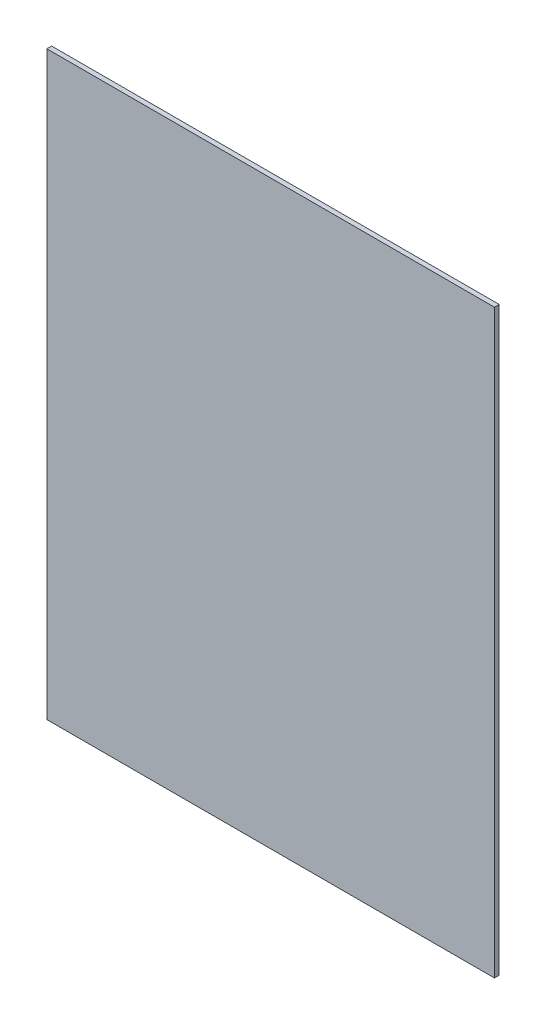
from build123d import *

# Parameters (mm, degrees)
SKETCH1_W           = 596.9
SKETCH1_H           = 774.7
BOSS_EXTRUDE1_DEPTH = 6.35


with BuildPart() as part:
    # Sketch1 → Boss-Extrude1 (new body)
    with BuildSketch(Plane.XY):
        with Locations((0, 387.35)):
            Rectangle(SKETCH1_W, SKETCH1_H)
    extrude(amount=BOSS_EXTRUDE1_DEPTH)


solid = part.part
